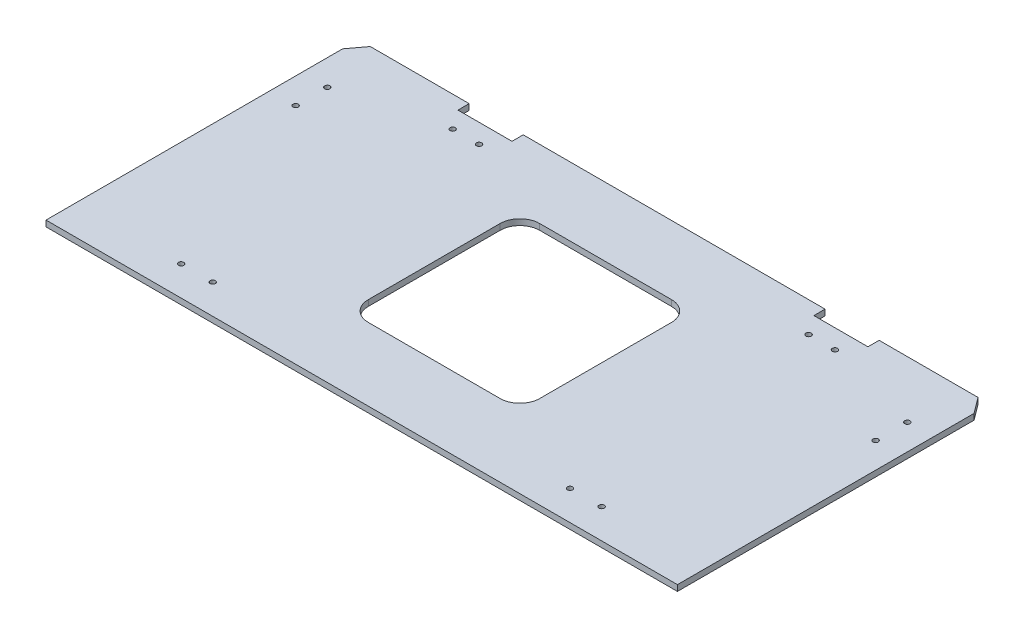
from build123d import *

# Parameters (mm, degrees)
SKETCH_1_W          = 479
SKETCH_1_H          = 237
EXTRUDE_1_DEPTH     = 4.5
CUT_EXTRUDE_1_REACH = 536.444
SKETCH_2_R          = 2
SKETCH_2_W          = 41
SKETCH_2_H          = 8.5
CUT_EXTRUDE_2_DEPTH = 10


with BuildPart() as part:
    # 草图1 → 凸台-拉伸1 (new body)
    with BuildSketch(Plane(origin=(0, 0, 0), x_dir=(1, 0, 0), z_dir=(0, 1, 0))):
        with Locations((239.5, 118.5)):
            Rectangle(SKETCH_1_W, SKETCH_1_H)
    extrude(amount=EXTRUDE_1_DEPTH)

    # 草图2 → 切除-拉伸1 (cut, up to next)
    with BuildSketch(Plane(origin=(0, 4.5, 0), x_dir=(1, 0, 0), z_dir=(0, 1, 0)), mode=Mode.PRIVATE) as cut_extrude_1_sk1:
        with Locations(Location((399, 22.5, 0), (0, 0, 270))):
            Circle(SKETCH_2_R)
    cut_extrude_1_tool1 = extrude(cut_extrude_1_sk1.sketch, amount=-CUT_EXTRUDE_1_REACH, mode=Mode.PRIVATE) & part.part
    # 草图2 → 切除-拉伸1 (cut, up to next)
    with BuildSketch(Plane(origin=(0, 4.5, 0), x_dir=(1, 0, 0), z_dir=(0, 1, 0)), mode=Mode.PRIVATE) as cut_extrude_1_sk2:
        with Locations(Location((375, 22.5, 0), (0, 0, 270))):
            Circle(SKETCH_2_R)
    cut_extrude_1_tool2 = extrude(cut_extrude_1_sk2.sketch, amount=-CUT_EXTRUDE_1_REACH, mode=Mode.PRIVATE) & part.part
    # 草图2 → 切除-拉伸1 (cut, up to next)
    with BuildSketch(Plane(origin=(0, 4.5, 0), x_dir=(1, 0, 0), z_dir=(0, 1, 0)), mode=Mode.PRIVATE) as cut_extrude_1_sk3:
        with Locations(Location((104, 22.5, 0), (0, 0, 90))):
            Circle(SKETCH_2_R)
    cut_extrude_1_tool3 = extrude(cut_extrude_1_sk3.sketch, amount=-CUT_EXTRUDE_1_REACH, mode=Mode.PRIVATE) & part.part
    # 草图2 → 切除-拉伸1 (cut, up to next)
    with BuildSketch(Plane(origin=(0, 4.5, 0), x_dir=(1, 0, 0), z_dir=(0, 1, 0)), mode=Mode.PRIVATE) as cut_extrude_1_sk4:
        with Locations(Location((80, 22.5, 0), (0, 0, 90))):
            Circle(SKETCH_2_R)
    cut_extrude_1_tool4 = extrude(cut_extrude_1_sk4.sketch, amount=-CUT_EXTRUDE_1_REACH, mode=Mode.PRIVATE) & part.part
    # 草图2 → 切除-拉伸1 (cut, up to next)
    with BuildSketch(Plane(origin=(0, 4.5, 0), x_dir=(1, 0, 0), z_dir=(0, 1, 0)), mode=Mode.PRIVATE) as cut_extrude_1_sk5:
        with Locations(Location((459.5, 193.9, 0), (0, 0, 270))):
            Circle(SKETCH_2_R)
    cut_extrude_1_tool5 = extrude(cut_extrude_1_sk5.sketch, amount=-CUT_EXTRUDE_1_REACH, mode=Mode.PRIVATE) & part.part
    # 草图2 → 切除-拉伸1 (cut, up to next)
    with BuildSketch(Plane(origin=(0, 4.5, 0), x_dir=(1, 0, 0), z_dir=(0, 1, 0)), mode=Mode.PRIVATE) as cut_extrude_1_sk6:
        with Locations(Location((459.5, 169.9, 0), (0, 0, 270))):
            Circle(SKETCH_2_R)
    cut_extrude_1_tool6 = extrude(cut_extrude_1_sk6.sketch, amount=-CUT_EXTRUDE_1_REACH, mode=Mode.PRIVATE) & part.part
    # 草图2 → 切除-拉伸1 (cut, up to next)
    with BuildSketch(Plane(origin=(0, 4.5, 0), x_dir=(1, 0, 0), z_dir=(0, 1, 0)), mode=Mode.PRIVATE) as cut_extrude_1_sk7:
        with Locations(Location((19.5, 169.9, 0), (0, 0, 90))):
            Circle(SKETCH_2_R)
    cut_extrude_1_tool7 = extrude(cut_extrude_1_sk7.sketch, amount=-CUT_EXTRUDE_1_REACH, mode=Mode.PRIVATE) & part.part
    # 草图2 → 切除-拉伸1 (cut, up to next)
    with BuildSketch(Plane(origin=(0, 4.5, 0), x_dir=(1, 0, 0), z_dir=(0, 1, 0)), mode=Mode.PRIVATE) as cut_extrude_1_sk8:
        with Locations(Location((19.5, 193.9, 0), (0, 0, 90))):
            Circle(SKETCH_2_R)
    cut_extrude_1_tool8 = extrude(cut_extrude_1_sk8.sketch, amount=-CUT_EXTRUDE_1_REACH, mode=Mode.PRIVATE) & part.part
    # 草图2 → 切除-拉伸1 (cut, up to next)
    with BuildSketch(Plane(origin=(0, 4.5, 0), x_dir=(1, 0, 0), z_dir=(0, 1, 0)), mode=Mode.PRIVATE) as cut_extrude_1_sk9:
        with Locations(Location((94.5, 214, 0), (0, 0, 270))):
            Circle(SKETCH_2_R)
    cut_extrude_1_tool9 = extrude(cut_extrude_1_sk9.sketch, amount=-CUT_EXTRUDE_1_REACH, mode=Mode.PRIVATE) & part.part
    # 草图2 → 切除-拉伸1 (cut, up to next)
    with BuildSketch(Plane(origin=(0, 4.5, 0), x_dir=(1, 0, 0), z_dir=(0, 1, 0)), mode=Mode.PRIVATE) as cut_extrude_1_sk10:
        with Locations(Location((114.5, 214, 0), (0, 0, 270))):
            Circle(SKETCH_2_R)
    cut_extrude_1_tool10 = extrude(cut_extrude_1_sk10.sketch, amount=-CUT_EXTRUDE_1_REACH, mode=Mode.PRIVATE) & part.part
    # 草图2 → 切除-拉伸1 (cut, up to next)
    with BuildSketch(Plane(origin=(0, 4.5, 0), x_dir=(1, 0, 0), z_dir=(0, 1, 0)), mode=Mode.PRIVATE) as cut_extrude_1_sk11:
        with Locations(Location((364.5, 214, 0), (0, 0, 90))):
            Circle(SKETCH_2_R)
    cut_extrude_1_tool11 = extrude(cut_extrude_1_sk11.sketch, amount=-CUT_EXTRUDE_1_REACH, mode=Mode.PRIVATE) & part.part
    # 草图2 → 切除-拉伸1 (cut, up to next)
    with BuildSketch(Plane(origin=(0, 4.5, 0), x_dir=(1, 0, 0), z_dir=(0, 1, 0)), mode=Mode.PRIVATE) as cut_extrude_1_sk12:
        with Locations(Location((384.5, 214, 0), (0, 0, 90))):
            Circle(SKETCH_2_R)
    cut_extrude_1_tool12 = extrude(cut_extrude_1_sk12.sketch, amount=-CUT_EXTRUDE_1_REACH, mode=Mode.PRIVATE) & part.part
    # 草图2 → 切除-拉伸1 (cut, up to next)
    with BuildSketch(Plane(origin=(0, 4.5, 0), x_dir=(1, 0, 0), z_dir=(0, 1, 0)), mode=Mode.PRIVATE) as cut_extrude_1_sk13:
        Polygon((0, 237), (0, 225), (9, 237), align=None)
    cut_extrude_1_tool13 = extrude(cut_extrude_1_sk13.sketch, amount=-CUT_EXTRUDE_1_REACH, mode=Mode.PRIVATE) & part.part
    # 草图2 → 切除-拉伸1 (cut, up to next)
    with BuildSketch(Plane(origin=(0, 4.5, 0), x_dir=(1, 0, 0), z_dir=(0, 1, 0)), mode=Mode.PRIVATE) as cut_extrude_1_sk14:
        Polygon((470, 237), (479, 237), (479, 225), align=None)
    cut_extrude_1_tool14 = extrude(cut_extrude_1_sk14.sketch, amount=-CUT_EXTRUDE_1_REACH, mode=Mode.PRIVATE) & part.part
    # 草图2 → 切除-拉伸1 (cut, up to next)
    with BuildSketch(Plane(origin=(0, 4.5, 0), x_dir=(1, 0, 0), z_dir=(0, 1, 0)), mode=Mode.PRIVATE) as cut_extrude_1_sk15:
        with Locations((104.5, 232.75)):
            Rectangle(SKETCH_2_W, SKETCH_2_H)
    cut_extrude_1_tool15 = extrude(cut_extrude_1_sk15.sketch, amount=-CUT_EXTRUDE_1_REACH, mode=Mode.PRIVATE) & part.part
    # 草图2 → 切除-拉伸1 (cut, up to next)
    with BuildSketch(Plane(origin=(0, 4.5, 0), x_dir=(1, 0, 0), z_dir=(0, 1, 0)), mode=Mode.PRIVATE) as cut_extrude_1_sk16:
        with Locations((374.5, 232.75)):
            Rectangle(SKETCH_2_W, SKETCH_2_H)
    cut_extrude_1_tool16 = extrude(cut_extrude_1_sk16.sketch, amount=-CUT_EXTRUDE_1_REACH, mode=Mode.PRIVATE) & part.part
    add(cut_extrude_1_tool1.solids().sort_by_distance((399, 4.5, -22.5))[0], mode=Mode.SUBTRACT)
    add(cut_extrude_1_tool2.solids().sort_by_distance((375, 4.5, -22.5))[0], mode=Mode.SUBTRACT)
    add(cut_extrude_1_tool3.solids().sort_by_distance((104, 4.5, -22.5))[0], mode=Mode.SUBTRACT)
    add(cut_extrude_1_tool4.solids().sort_by_distance((80, 4.5, -22.5))[0], mode=Mode.SUBTRACT)
    add(cut_extrude_1_tool5.solids().sort_by_distance((459.5, 4.5, -193.9))[0], mode=Mode.SUBTRACT)
    add(cut_extrude_1_tool6.solids().sort_by_distance((459.5, 4.5, -169.9))[0], mode=Mode.SUBTRACT)
    add(cut_extrude_1_tool7.solids().sort_by_distance((19.5, 4.5, -169.9))[0], mode=Mode.SUBTRACT)
    add(cut_extrude_1_tool8.solids().sort_by_distance((19.5, 4.5, -193.9))[0], mode=Mode.SUBTRACT)
    add(cut_extrude_1_tool9.solids().sort_by_distance((94.5, 4.5, -214))[0], mode=Mode.SUBTRACT)
    add(cut_extrude_1_tool10.solids().sort_by_distance((114.5, 4.5, -214))[0], mode=Mode.SUBTRACT)
    add(cut_extrude_1_tool11.solids().sort_by_distance((364.5, 4.5, -214))[0], mode=Mode.SUBTRACT)
    add(cut_extrude_1_tool12.solids().sort_by_distance((384.5, 4.5, -214))[0], mode=Mode.SUBTRACT)
    add(cut_extrude_1_tool13.solids().sort_by_distance((3, 4.5, -233))[0], mode=Mode.SUBTRACT)
    add(cut_extrude_1_tool14.solids().sort_by_distance((476, 4.5, -233))[0], mode=Mode.SUBTRACT)
    add(cut_extrude_1_tool15.solids().sort_by_distance((104.5, 4.5, -232.75))[0], mode=Mode.SUBTRACT)
    add(cut_extrude_1_tool16.solids().sort_by_distance((374.5, 4.5, -232.75))[0], mode=Mode.SUBTRACT)

    # 草图3 → 切除-拉伸2 (cut)
    with BuildSketch(Plane(origin=(0, 4.5, 0), x_dir=(1, 0, 0), z_dir=(0, 1, 0))):
        with BuildLine():
            Line((289.5, 55), (189.5, 55))
            ThreePointArc((189.5, 55), (178.893398282, 59.393398282), (174.5, 70))
            Line((174.5, 70), (174.5, 170))
            ThreePointArc((174.5, 170), (178.893398282, 180.606601718), (189.5, 185))
            Line((189.5, 185), (289.5, 185))
            ThreePointArc((289.5, 185), (300.106601718, 180.606601718), (304.5, 170))
            Line((304.5, 170), (304.5, 70))
            ThreePointArc((304.5, 70), (300.106601718, 59.393398282), (289.5, 55))
        make_face()
    extrude(amount=-CUT_EXTRUDE_2_DEPTH, mode=Mode.SUBTRACT)


solid = part.part
